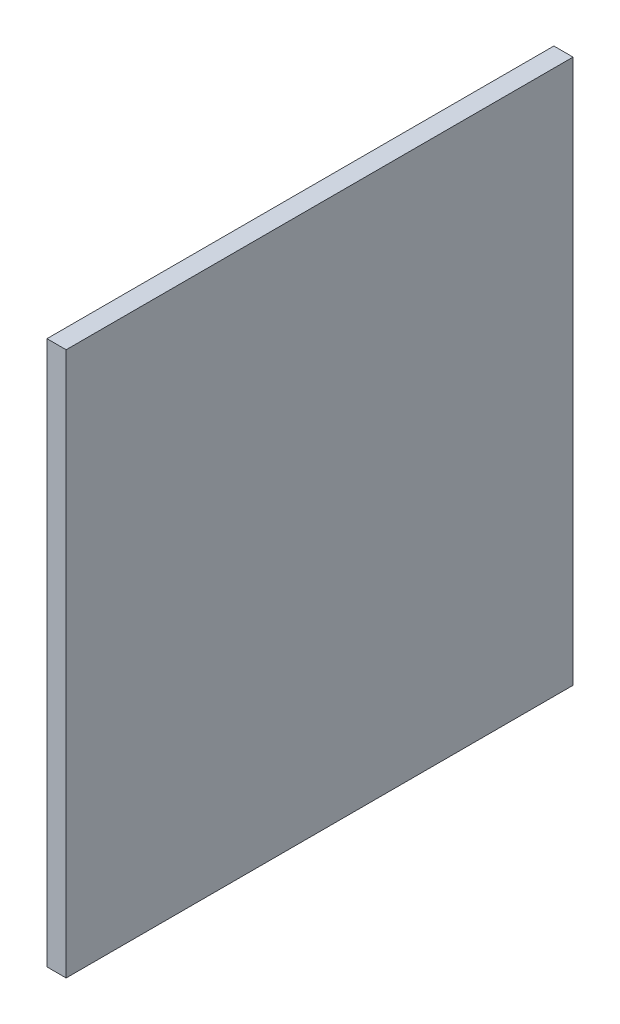
from build123d import *

# Parameters (mm, degrees)
SKETCH1_W           = 167.7
SKETCH1_H           = 180
BOSS_EXTRUDE1_DEPTH = 6.35


with BuildPart() as part:
    # Sketch1 → Boss-Extrude1 (new body)
    with BuildSketch(Plane(origin=(0, 0, 0), x_dir=(0, 0, -1), z_dir=(1, 0, 0))):
        Rectangle(SKETCH1_W, SKETCH1_H)
    extrude(amount=BOSS_EXTRUDE1_DEPTH)


solid = part.part
